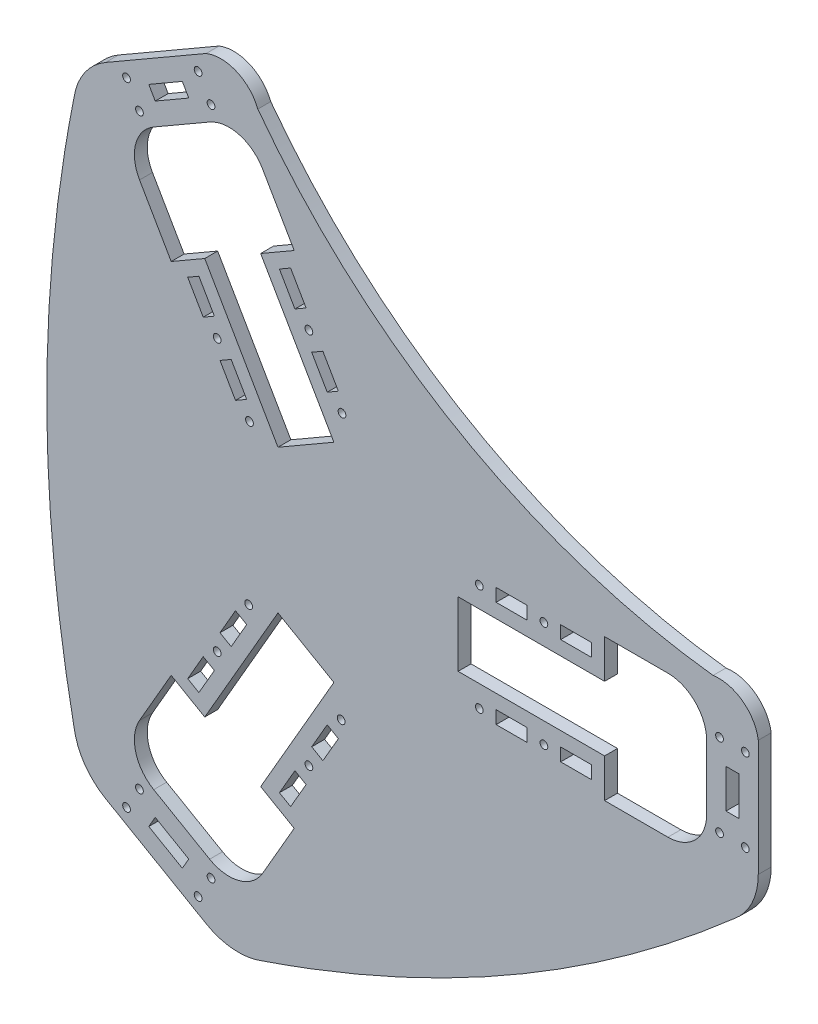
from build123d import *
from build123d.topology import SkipClean

# Parameters (mm, degrees)
BOSS_EXTRUDE1_DEPTH = 5
BOSS_EXTRUDE2_DEPTH = 5
SKETCH4_R           = 1.5
SKETCH4_W           = 21.014084041
SKETCH4_H           = 55
SKETCH4_W_2         = 12
SKETCH4_H_2         = 5
CUT_EXTRUDE1_DEPTH  = 5
CIRPATTERN1_COUNT   = 3
SKETCH5_R           = 188.544827525
CUT_EXTRUDE2_DEPTH  = 5
BOSS_EXTRUDE3_DEPTH = 5
BOSS_EXTRUDE4_DEPTH = 5
BOSS_EXTRUDE5_START = -5
BOSS_EXTRUDE5_DEPTH = 5
CUT_EXTRUDE3_START  = -5
CUT_EXTRUDE3_DEPTH  = 5
SKETCH8_R           = 1.5
SKETCH8_W           = 5
SKETCH8_H           = 15
CUT_EXTRUDE4_DEPTH  = 10
CIRPATTERN2_COUNT   = 3


with BuildPart() as part:
    # Sketch1 → Boss-Extrude1 (new body)
    with BuildSketch(Plane.XY):
        with BuildLine():
            Line((-8.818414939, -40.273942716), (-43.818414939, -100.895720981))
            ThreePointArc((-43.818414939, -100.895720981), (55, -95.262794416), (109.287464972, -12.5))
            Line((109.287464972, -12.5), (39.287464972, -12.5))
            Line((39.287464972, -12.5), (39.287464972, 12.5))
            Line((39.287464972, 12.5), (109.287464972, 12.5))
            ThreePointArc((109.287464972, 12.5), (55, 95.262794416), (-43.818414939, 100.895720981))
            Line((-43.818414939, 100.895720981), (-8.818414939, 40.273942716))
            Line((-8.818414939, 40.273942716), (-30.469050033, 27.773942716))
            Line((-30.469050033, 27.773942716), (-65.469050033, 88.395720981))
            ThreePointArc((-65.469050033, 88.395720981), (-110, 0), (-65.469050033, -88.395720981))
            Line((-65.469050033, -88.395720981), (-30.469050033, -27.773942716))
            Line((-30.469050033, -27.773942716), (-8.818414939, -40.273942716))
        make_face()
    extrude(amount=BOSS_EXTRUDE1_DEPTH)

    # Sketch3 → Boss-Extrude2 (add)
    with BuildSketch(Plane.XY.offset(5)):
        with BuildLine():
            Line((145.507042021, -22.5), (145.507042021, 22.5))
            ThreePointArc((145.507042021, 22.5), (141.113643739, 33.106601718), (130.507042021, 37.5))
            Line((130.507042021, 37.5), (96.507042021, 37.5))
            Line((96.507042021, 37.5), (96.507042021, -37.5))
            Line((96.507042021, -37.5), (130.507042021, -37.5))
            ThreePointArc((130.507042021, -37.5), (141.113643739, -33.106601718), (145.507042021, -22.5))
        make_face()
        with BuildLine():
            Line((120.507042021, -27.5), (106.507042021, -27.5))
            Line((106.507042021, -27.5), (106.507042021, 27.5))
            Line((106.507042021, 27.5), (120.507042021, 27.5))
            ThreePointArc((120.507042021, 27.5), (131.113643739, 23.106601718), (135.507042021, 12.5))
            Line((135.507042021, 12.5), (135.507042021, -12.5))
            ThreePointArc((135.507042021, -12.5), (131.113643739, -23.106601718), (120.507042021, -27.5))
        make_face(mode=Mode.SUBTRACT)
    boss_extrude2 = extrude(amount=-BOSS_EXTRUDE2_DEPTH)

    # Sketch4 → Cut-Extrude1 (cut)
    with BuildSketch(Plane.XY.offset(5)):
        with Locations((72.5, -20.5)):
            Circle(SKETCH4_R)
        with Locations((72.5, 20.5)):
            Circle(SKETCH4_R)
        with Locations((47.5, 20.5)):
            Circle(SKETCH4_R)
        with Locations((47.5, -20.861898396)):
            Circle(SKETCH4_R)
        with Locations((106.50704202, 0)):
            Rectangle(SKETCH4_W, SKETCH4_H)
        with Locations((85, -20.5)):
            Rectangle(SKETCH4_W_2, SKETCH4_H_2)
        with Locations((60, -20.5)):
            Rectangle(SKETCH4_W_2, SKETCH4_H_2)
        with Locations((85, 20.5)):
            Rectangle(SKETCH4_W_2, SKETCH4_H_2)
        with Locations((60, 20.5)):
            Rectangle(SKETCH4_W_2, SKETCH4_H_2)
    cut_extrude1 = extrude(amount=-CUT_EXTRUDE1_DEPTH, mode=Mode.SUBTRACT)

    # CirPattern1: Boss-Extrude2, Cut-Extrude1 ×3 about axis
    cirpattern1_axis = Axis((0, 0, 5), (0, 0, 1))
    add([boss_extrude2.rotate(cirpattern1_axis, i * 360 / CIRPATTERN1_COUNT) for i in range(1, CIRPATTERN1_COUNT)])
    add([cut_extrude1.rotate(cirpattern1_axis, i * 360 / CIRPATTERN1_COUNT) for i in range(1, CIRPATTERN1_COUNT)], mode=Mode.SUBTRACT)

    # Sketch5 → Cut-Extrude2 (cut)
    with BuildSketch(Plane.XY.offset(5)):
        with Locations((130.507042021, 226.044827525)):
            Circle(SKETCH5_R)
    extrude(amount=-CUT_EXTRUDE2_DEPTH, mode=Mode.SUBTRACT)

    # Sketch5<2> → Boss-Extrude3 (add)
    with SkipClean():  # the faces are left unmerged after this step: merging them gives an invalid solid
        with BuildSketch(Plane.XY.offset(5)):
            with BuildLine():
                ThreePointArc((130.507042021, 37.5), (36.234628258, 62.760217136), (-32.777568368, 131.772413763))
                ThreePointArc((-32.777568368, 131.772413763), (30.05166829, 52.051016331), (130.507042021, 37.5))
            make_face()
        extrude(amount=-BOSS_EXTRUDE3_DEPTH)

    # Sketch6 → Boss-Extrude4 (add)
    with SkipClean():  # the faces are left unmerged after this step: merging them gives an invalid solid
        with BuildSketch(Plane.XY.offset(5)):
            with BuildLine():
                add(Edge.make_bspline(
                    [(141.113643739, -33.106601718), (60.386010005, -104.591637395), (-41.885663749, -138.761301157)],
                    knots=[0, 0, 0, 1, 1, 1], degree=2))
                ThreePointArc((141.113643739, -33.106601718), (27.732185277, -48.033553904), (-41.885663749, -138.761301157))
            make_face()
            with BuildLine():
                ThreePointArc((-99.22797999, -105.654699439), (-55.464370554, 0), (-99.22797999, 105.654699439))
                add(Edge.make_bspline(
                    [(-99.22797999, 105.654699439), (-120.77202001, 0), (-99.22797999, -105.654699439)],
                    knots=[0, 0, 0, 1, 1, 1], degree=2))
            make_face()
        extrude(amount=-BOSS_EXTRUDE4_DEPTH)

    # Sketch7 → Boss-Extrude5 (add)
    with BuildSketch(Plane(origin=(0, 0, 0), x_dir=(-1, 0, 0), z_dir=(0, 0, -1)).offset(BOSS_EXTRUDE5_START)):
        with BuildLine():
            Line((-155.507042021, 22.5), (-155.507042021, -22.5))
            ThreePointArc((-155.507042021, -22.5), (-153.037379973, -33.334383774), (-146.11633228, -42.028186234))
            add(Edge.make_bspline(
                [(36.660689186, -147.554548779), (2.706672334, -136.063921523), (-29.525971209, -121.51723718), (-90.474028791, -86.328859728), (-119.188148744, -65.68791376), (-146.11633228, -42.028186234)],
                knots=[0, 0, 0, 0, 0.5, 0.5, 1, 1, 1, 1], degree=3))
            ThreePointArc((36.660689186, -147.554548779), (47.650266819, -149.201450672), (58.267949425, -145.923048857))
            Line((58.267949425, -145.923048857), (97.239092596, -123.423048857))
            ThreePointArc((97.239092596, -123.423048857), (105.387113154, -115.867066899), (109.455643094, -105.526362546))
            add(Edge.make_bspline(
                [(109.455643094, 105.526362546), (116.48147641, 70.376007763), (120, 35.188377452), (120, -35.188377452), (116.48147641, -70.376007763), (109.455643094, -105.526362546)],
                knots=[0, 0, 0, 0, 0.5, 0.5, 1, 1, 1, 1], degree=3))
            ThreePointArc((109.455643094, 105.526362546), (105.387113154, 115.867066899), (97.239092596, 123.423048857))
            Line((97.239092596, 123.423048857), (58.267949425, 145.923048857))
            ThreePointArc((58.267949425, 145.923048857), (46.474352087, 145.735057462), (38.267949425, 137.262794819))
            ThreePointArc((38.267949425, 137.262794819), (45.767949425, 139.272413763), (53.267949425, 137.262794819))
            Line((53.267949425, 137.262794819), (92.239092596, 114.762794819))
            ThreePointArc((92.239092596, 114.762794819), (97.185203012, 110.144649755), (99.598321301, 103.822614307))
            add(Edge.make_bspline(
                [(99.598321301, -103.822614309), (120.401678699, -1e-09), (99.598321301, 103.822614307)],
                knots=[0, 0, 0, 1, 1, 1], degree=2))
            ThreePointArc((99.598321301, -103.822614309), (97.185203011, -110.144649756), (92.239092596, -114.762794819))
            Line((92.239092596, -114.762794819), (53.267949425, -137.262794819))
            ThreePointArc((53.267949425, -137.262794819), (46.795463273, -139.237179557), (40.113860827, -138.165983575))
            add(Edge.make_bspline(
                [(-139.712182129, -34.343369266), (-60.20083935, -104.270912411), (40.113860827, -138.165983575)],
                knots=[0, 0, 0, 1, 1, 1], degree=2))
            ThreePointArc((-139.712182129, -34.343369266), (-143.980666285, -29.092529802), (-145.507042021, -22.5))
            Line((-145.507042021, -22.5), (-145.507042021, 22.5))
            ThreePointArc((-145.507042021, 22.5), (-143.497423077, 30), (-138.007042021, 35.490381057))
            ThreePointArc((-138.007042021, 35.490381057), (-149.447438028, 32.619559199), (-155.507042021, 22.5))
        make_face()
        with BuildLine():
            ThreePointArc((29.086468731, 125.650289264), (-39.369546298, 68.190054459), (-123.359576861, 37.635523805))
            ThreePointArc((-123.359576861, 37.635523805), (-36.234628258, 62.760217136), (29.086468731, 125.650289264))
        make_face()
    extrude(amount=BOSS_EXTRUDE5_DEPTH)

    # Sketch7<3> → Cut-Extrude3 (cut)
    with BuildSketch(Plane(origin=(0, 0, 0), x_dir=(-1, 0, 0), z_dir=(0, 0, -1)).offset(CUT_EXTRUDE3_START)):
        with BuildLine():
            ThreePointArc((-130.507042021, 37.5), (-134.389327697, 36.988887394), (-138.007042021, 35.490381057))
            ThreePointArc((-138.007042021, 35.490381057), (-130.667867293, 36.457510349), (-123.359576861, 37.635523805))
            ThreePointArc((-123.359576861, 37.635523805), (-126.932667079, 37.533883996), (-130.507042021, 37.5))
        make_face()
        with BuildLine():
            ThreePointArc((32.777568368, 131.772413763), (30.961036496, 128.693856258), (29.086468731, 125.650289264))
            ThreePointArc((29.086468731, 125.650289264), (33.760803526, 131.390447709), (38.267949425, 137.262794819))
            ThreePointArc((38.267949425, 137.262794819), (35.161347707, 134.87901548), (32.777568368, 131.772413763))
        make_face()
    extrude(amount=CUT_EXTRUDE3_DEPTH, mode=Mode.SUBTRACT)

    # Sketch8 → Cut-Extrude4 (cut)
    with BuildSketch(Plane(origin=(0, 0, 0), x_dir=(-1, 0, 0), z_dir=(0, 0, -1))):
        with Locations((-140.507042021, 16)):
            Circle(SKETCH8_R)
        with Locations((-140.507042021, -16)):
            Circle(SKETCH8_R)
        with Locations((-150.507042021, -16)):
            Circle(SKETCH8_R)
        with Locations((-150.507042021, 16)):
            Circle(SKETCH8_R)
        with Locations((-145.507042021, 0)):
            Rectangle(SKETCH8_W, SKETCH8_H)
    cut_extrude4 = extrude(amount=-CUT_EXTRUDE4_DEPTH, mode=Mode.SUBTRACT)

    # CirPattern2: Cut-Extrude4 ×3 about axis
    cirpattern2_axis = Axis((0, 0, 0), (0, 0, -1))
    for i in range(1, CIRPATTERN2_COUNT):
        add(cut_extrude4.rotate(cirpattern2_axis, i * 360 / CIRPATTERN2_COUNT), mode=Mode.SUBTRACT)


solid = part.part
